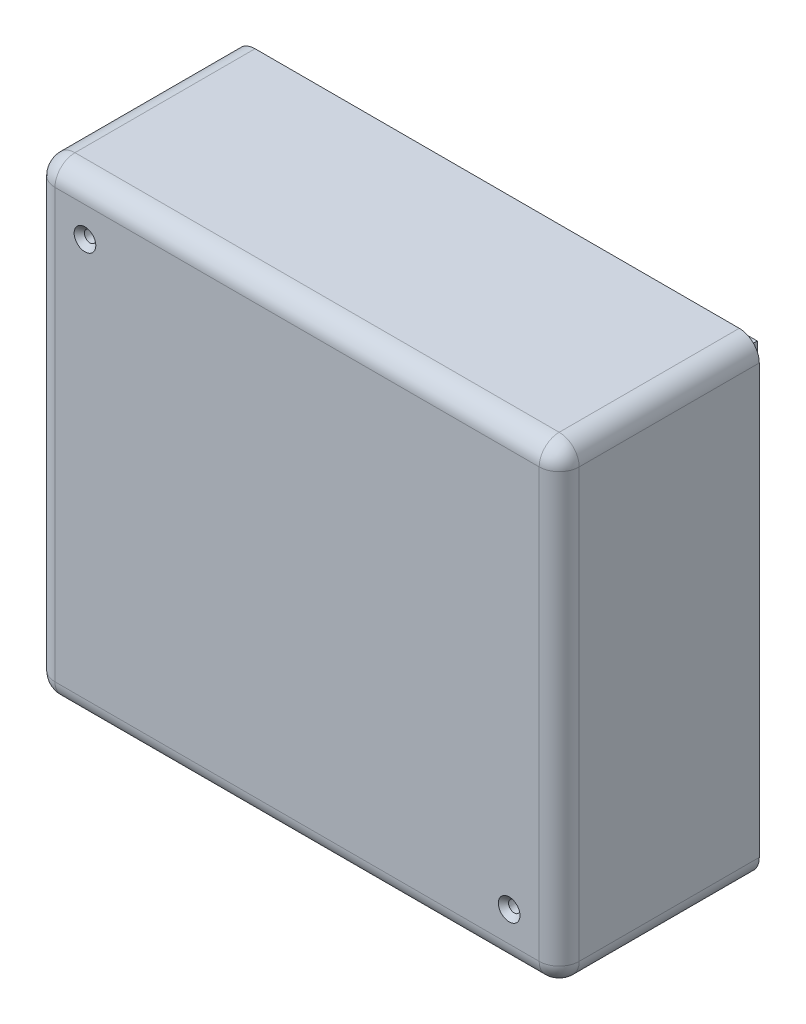
from build123d import *

# Parameters (mm, degrees)
SKETCH3_W                                         = 133.096
SKETCH3_H                                         = 118.872
BOSS_EXTRUDE1_DEPTH                               = 50.8
BOSS_EXTRUDE2_DEPTH                               = 2.54
SKETCH11_W                                        = 121.92
SKETCH11_H                                        = 107.696
CUT_EXTRUDE1_DEPTH                                = 46.99
SKETCH12_W                                        = 16.456007839
SKETCH12_H                                        = 62.484
CUT_EXTRUDE2_DEPTH                                = 12.7
FILLET1_R                                         = 5.08
CSK_FOR_M2_5_FLAT_HEAD_MACHINE_SCREW1_D           = 2.9
CSK_FOR_M2_5_FLAT_HEAD_MACHINE_SCREW1_DEPTH       = 5.08
CSK_FOR_M2_5_FLAT_HEAD_MACHINE_SCREW1_CSINK_D     = 5.5
CSK_FOR_M2_5_FLAT_HEAD_MACHINE_SCREW1_CSINK_ANGLE = 90
CSK_FOR_M2_5_FLAT_HEAD_MACHINE_SCREW1_TIP         = 0.871247898


with BuildPart() as part:
    # Sketch3 → Boss-Extrude1 (new body)
    with BuildSketch(Plane.XY):
        with Locations((66.548, 59.436)):
            Rectangle(SKETCH3_W, SKETCH3_H)
    extrude(amount=BOSS_EXTRUDE1_DEPTH)

    # Sketch3<5> → Boss-Extrude2 (add)
    with BuildSketch(Plane.XY):
        Polygon((130.048, 115.824), (3.048, 115.824), (3.048, 74.168), (3.048, 11.684), (3.048, 3.048), (130.048, 3.048), align=None)
        Polygon((5.588, 74.168), (5.588, 113.284), (127.508, 113.284), (127.508, 5.588), (5.588, 5.588), (5.588, 11.684), align=None, mode=Mode.SUBTRACT)
    extrude(amount=-BOSS_EXTRUDE2_DEPTH)

    # Sketch11 → Cut-Extrude1 (cut)
    with BuildSketch(Plane(origin=(0, 0, 0), x_dir=(-1, 0, 0), z_dir=(0, 0, -1))):
        with Locations((-66.548, 59.436)):
            Rectangle(SKETCH11_W, SKETCH11_H)
    extrude(amount=-CUT_EXTRUDE1_DEPTH, mode=Mode.SUBTRACT)

    # Sketch12 → Cut-Extrude2 (cut)
    with BuildSketch(Plane.ZY):
        with Locations((5.688003919, 42.926)):
            Rectangle(SKETCH12_W, SKETCH12_H)
    extrude(amount=-CUT_EXTRUDE2_DEPTH, mode=Mode.SUBTRACT)

    # Fillet1
    fillet1_edges = [part.edges().sort_by_distance(p)[0] for p in [
        (133.096, 59.436, 50.8),
        (66.548, 118.872, 50.8),
        (0, 59.436, 50.8),
        (0, 118.872, 25.4),
        (133.096, 118.872, 25.4),
        (133.096, 0, 25.4),
        (0, 0, 25.4),
        (66.548, 0, 50.8),
    ]]
    fillet(fillet1_edges, radius=FILLET1_R)

    # CSK for M2.5 Flat Head Machine Screw1
    with Locations(Plane.XY.offset(50.8)):
        with Locations((12.7, 106.172), (120.396, 12.7)):
            CounterSinkHole(CSK_FOR_M2_5_FLAT_HEAD_MACHINE_SCREW1_D / 2, CSK_FOR_M2_5_FLAT_HEAD_MACHINE_SCREW1_CSINK_D / 2, depth=CSK_FOR_M2_5_FLAT_HEAD_MACHINE_SCREW1_DEPTH, counter_sink_angle=CSK_FOR_M2_5_FLAT_HEAD_MACHINE_SCREW1_CSINK_ANGLE)
            with Locations((0, 0, -(CSK_FOR_M2_5_FLAT_HEAD_MACHINE_SCREW1_DEPTH + CSK_FOR_M2_5_FLAT_HEAD_MACHINE_SCREW1_TIP / 2))):  # 118° drill point
                Cone(0, CSK_FOR_M2_5_FLAT_HEAD_MACHINE_SCREW1_D / 2, CSK_FOR_M2_5_FLAT_HEAD_MACHINE_SCREW1_TIP, mode=Mode.SUBTRACT)


solid = part.part
